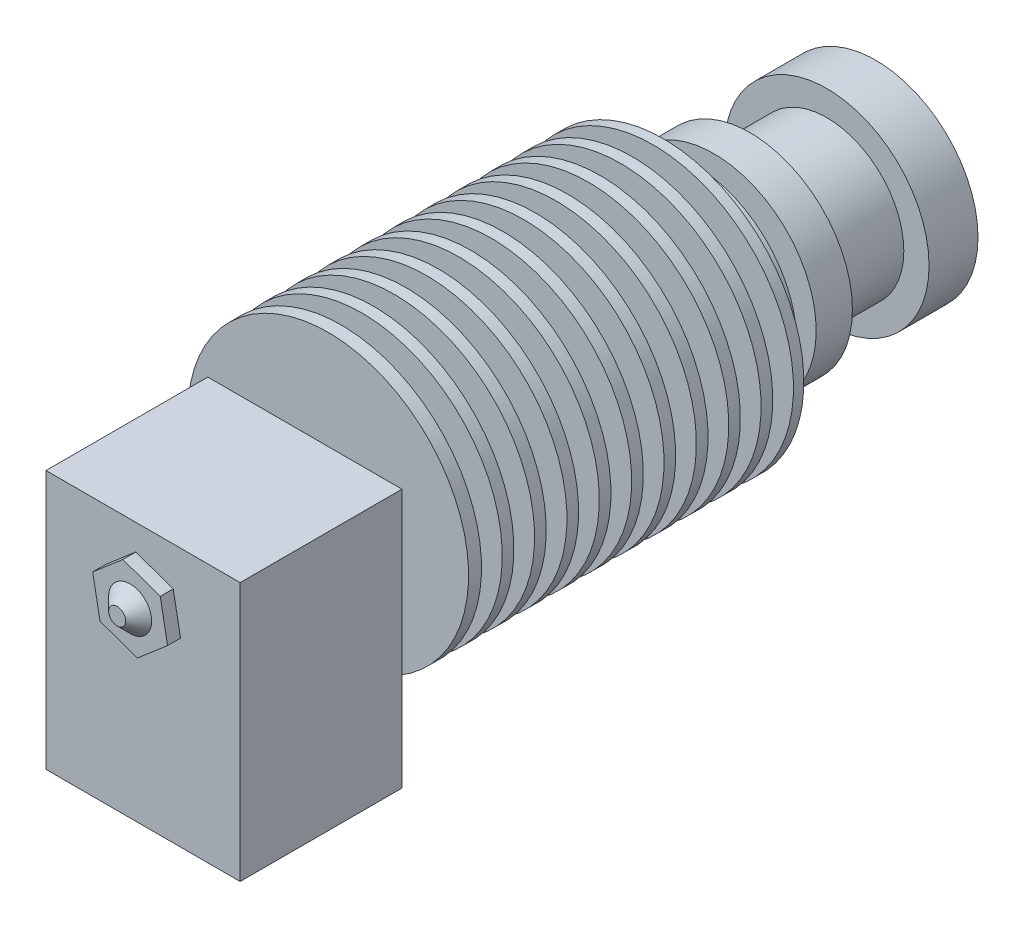
from build123d import *

# Parameters (mm, degrees)
SKETCH1_R           = 10.845
BOSS_EXTRUDE1_DEPTH = 25.9
SKETCH2_W           = 5.345
SKETCH2_H           = 1.6
LPATTERN1_COUNT     = 10
LPATTERN1_PITCH     = 2.5
SKETCH3_R           = 7.9
BOSS_EXTRUDE2_DEPTH = 16.4
SKETCH4_W           = 1.95
SKETCH4_H           = 5.92
SKETCH4_W_2         = 2.9
SKETCH4_H_2         = 1.5
SKETCH5_R           = 2
BOSS_EXTRUDE3_DEPTH = 1.8
SKETCH6_W           = 15
SKETCH6_H           = 20
BOSS_EXTRUDE4_DEPTH = 12.5
BOSS_EXTRUDE5_DEPTH = 1
SKETCH8_R           = 1.65934661
BOSS_EXTRUDE6_DEPTH = 1
BOSS_EXTRUDE6_TAPER = 45


with BuildPart() as part:
    # Sketch1 → Boss-Extrude1 (new body)
    with BuildSketch(Plane.XY):
        with Locations(Location((0, 0, 0), (0, 0, 180))):
            Circle(SKETCH1_R)
    extrude(amount=BOSS_EXTRUDE1_DEPTH)

    # Sketch2 → Cut-Revolve1 (revolve, cut)
    with BuildSketch(Plane(origin=(0, 0, 0), x_dir=(1, 0, 0), z_dir=(0, 1, 0))):
        with Locations((-8.1725, -1.6)):
            Rectangle(SKETCH2_W, SKETCH2_H)
    cut_revolve1 = revolve(axis=Axis((0, 0, 0), (0, 0, 1)), mode=Mode.SUBTRACT)

    # LPattern1: Cut-Revolve1 ×10
    with Locations(*[(0, 0, i * LPATTERN1_PITCH) for i in range(1, LPATTERN1_COUNT)]):
        add(cut_revolve1, mode=Mode.SUBTRACT)

    # Sketch3 → Boss-Extrude2 (add)
    with BuildSketch(Plane(origin=(0, 0, 0), x_dir=(-1, 0, 0), z_dir=(0, 0, -1))):
        with Locations(Location((0, 0, 0), (0, 0, 180))):
            Circle(SKETCH3_R)
    extrude(amount=BOSS_EXTRUDE2_DEPTH)

    # Sketch4 → Cut-Revolve2 (revolve, cut)
    with BuildSketch(Plane(origin=(0, 0, 0), x_dir=(1, 0, 0), z_dir=(0, 1, 0)), mode=Mode.PRIVATE) as cut_revolve2_sk:
        with Locations((-6.925, 9.66)):
            Rectangle(SKETCH4_W, SKETCH4_H)
        with Locations((-6.45, 3.15)):
            Rectangle(SKETCH4_W_2, SKETCH4_H_2)
        with Locations((-6.45, 0.75)):
            Rectangle(SKETCH4_W_2, SKETCH4_H_2)
    revolve(cut_revolve2_sk.sketch.rotate(Axis((0, 0, 0), (0, 0, -1)), 180), axis=Axis((0, 0, 0), (0, 0, -1)), mode=Mode.SUBTRACT)

    # Sketch5 → Boss-Extrude3 (add)
    with BuildSketch(Plane.XY.offset(25.9)):
        Circle(SKETCH5_R)
    extrude(amount=BOSS_EXTRUDE3_DEPTH)

    # Sketch6 → Boss-Extrude4 (add)
    with BuildSketch(Plane.XY.offset(27.7)):
        with Locations((0, -5)):
            Rectangle(SKETCH6_W, SKETCH6_H)
    extrude(amount=BOSS_EXTRUDE4_DEPTH)

    # Sketch7 → Boss-Extrude5 (add)
    with BuildSketch(Plane.XY.offset(40.2)):
        Polygon((2.891396573, -1.018451956), (2.327703553, 1.994796907), (-0.56369302, 3.013248863), (-2.891396573, 1.018451956), (-2.327703553, -1.994796907), (0.56369302, -3.013248863), align=None)
    extrude(amount=BOSS_EXTRUDE5_DEPTH)

    # Sketch8 → Boss-Extrude6 (add)
    with BuildSketch(Plane.XY.offset(41.2)):
        Circle(SKETCH8_R)
    extrude(amount=BOSS_EXTRUDE6_DEPTH, taper=BOSS_EXTRUDE6_TAPER)


solid = part.part
